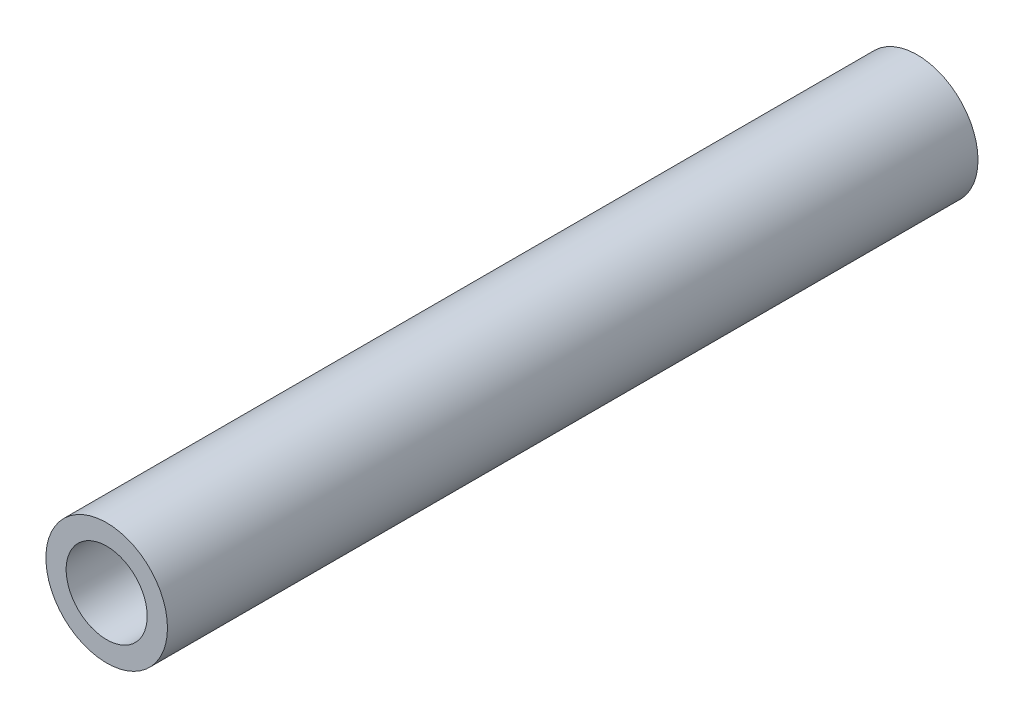
from build123d import *

# Parameters (mm, degrees)
SCHIZZO1_R                   = 3
SCHIZZO1_R_2                 = 2
ESTRUSIONE_ESTRUSIONE1_DEPTH = 40


with BuildPart() as part:
    # Schizzo1 → Estrusione-Estrusione1 (new body)
    with BuildSketch(Plane.XY.offset(33.42788034)):
        with Locations((230, -26.586432577)):
            Circle(SCHIZZO1_R)
        with Locations((230, -26.586432577)):
            Circle(SCHIZZO1_R_2, mode=Mode.SUBTRACT)
    extrude(amount=-ESTRUSIONE_ESTRUSIONE1_DEPTH)


solid = part.part
